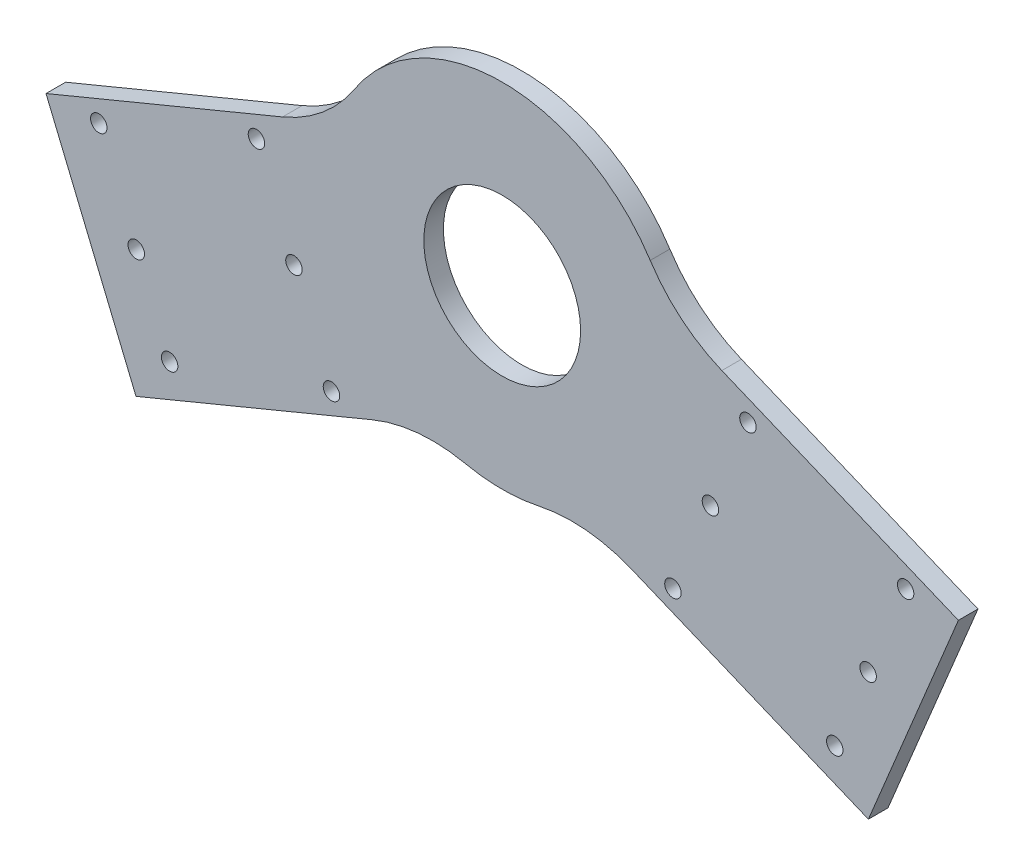
from build123d import *

# Parameters (mm, degrees)
SKETCH1_R           = 20
SKETCH1_R_2         = 2.1
BOSS_EXTRUDE1_DEPTH = 5
FILLET1_R           = 40


with BuildPart() as part:
    # Sketch1 → Boss-Extrude1 (new body)
    with BuildSketch(Plane.XY):
        with BuildLine():
            Line((-93.417721196, -71.166653094), (-116.378727138, -15.733881143))
            Line((-116.378727138, -15.733881143), (-42.468364537, 14.880793446))
            ThreePointArc((-42.468364537, 14.880793446), (0, 45), (42.468364537, 14.880793446))
            Line((42.468364537, 14.880793446), (116.378727138, -15.733881143))
            Line((116.378727138, -15.733881143), (93.417721196, -71.166653094))
            Line((93.417721196, -71.166653094), (19.507358595, -40.551978505))
            ThreePointArc((19.507358595, -40.551978505), (0, -45), (-19.507358595, -40.551978505))
            Line((-19.507358595, -40.551978505), (-93.417721196, -71.166653094))
        make_face()
        Circle(SKETCH1_R, mode=Mode.SUBTRACT)
        with Locations((-93.34973001, -38.666724214)):
            Circle(SKETCH1_R_2, mode=Mode.SUBTRACT)
        with Locations((-102.916815819, -15.569735901)):
            Circle(SKETCH1_R_2, mode=Mode.SUBTRACT)
        with Locations((-84.838757104, -59.214030433)):
            Circle(SKETCH1_R_2, mode=Mode.SUBTRACT)
        with Locations((84.838757104, -59.214030433)):
            Circle(SKETCH1_R_2, mode=Mode.SUBTRACT)
        with Locations((93.34973001, -38.666724214)):
            Circle(SKETCH1_R_2, mode=Mode.SUBTRACT)
        with Locations((102.916815819, -15.569735901)):
            Circle(SKETCH1_R_2, mode=Mode.SUBTRACT)
        with Locations((-62.691100974, 1.092300744)):
            Circle(SKETCH1_R_2, mode=Mode.SUBTRACT)
        with Locations((-53.124015165, -22.004687569)):
            Circle(SKETCH1_R_2, mode=Mode.SUBTRACT)
        with Locations((-43.556929356, -45.101675882)):
            Circle(SKETCH1_R_2, mode=Mode.SUBTRACT)
        with Locations((43.556929356, -45.101675882)):
            Circle(SKETCH1_R_2, mode=Mode.SUBTRACT)
        with Locations((53.124015165, -22.004687569)):
            Circle(SKETCH1_R_2, mode=Mode.SUBTRACT)
        with Locations((62.691100974, 1.092300744)):
            Circle(SKETCH1_R_2, mode=Mode.SUBTRACT)
    extrude(amount=BOSS_EXTRUDE1_DEPTH)

    # Fillet1
    fillet1_edges = [part.edges().sort_by_distance(p)[0] for p in [
        (-19.507358595, -40.551978505, 2.5),
        (-42.468364537, 14.880793446, 2.5),
        (42.468364537, 14.880793446, 2.5),
        (19.507358595, -40.551978505, 2.5),
    ]]
    fillet(fillet1_edges, radius=FILLET1_R)


solid = part.part
